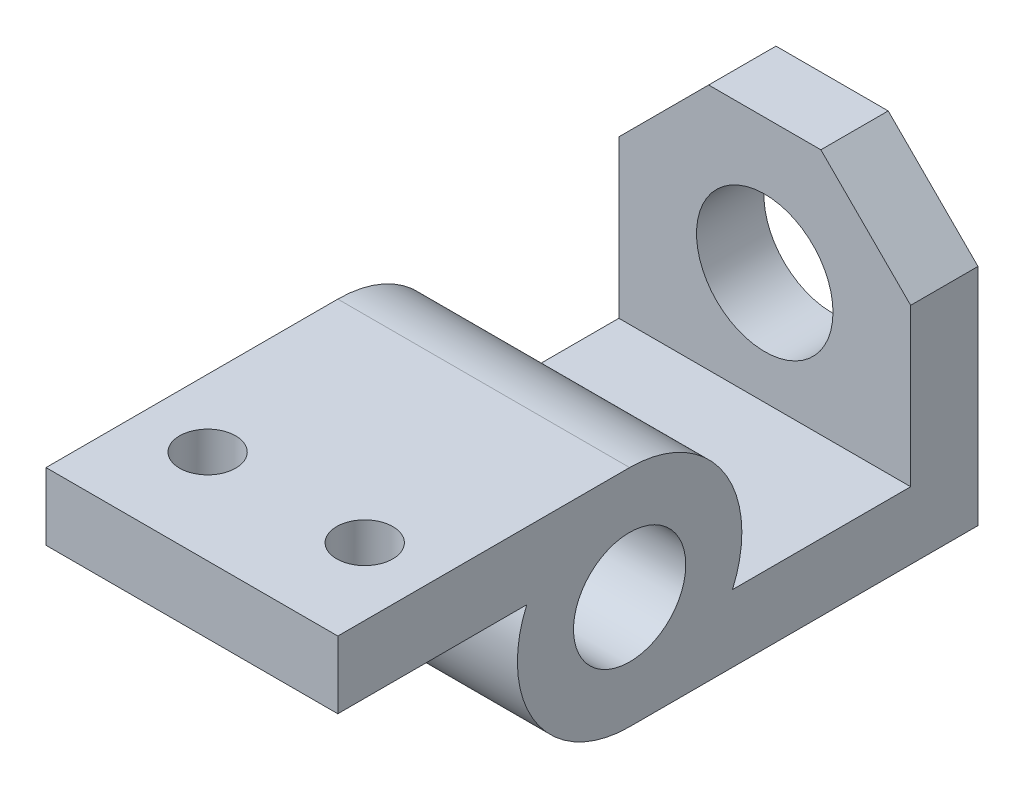
from build123d import *

# Parameters (mm, degrees)
SKETCH2_R           = 15.875
BOSS_EXTRUDE1_DEPTH = 82.55
SKETCH4_R           = 7.9375
CUT_EXTRUDE1_DEPTH  = 144.384968543
SKETCH5_R           = 19.304
CUT_EXTRUDE2_DEPTH  = 191.634403254


with BuildPart() as part:
    # Sketch2 → Boss-Extrude1 (new body)
    with BuildSketch(Plane(origin=(0, 0, 0), x_dir=(0, 0, -1), z_dir=(1, 0, 0))):
        with BuildLine():
            ThreePointArc((0, -31.75), (-26.563955842, -17.390191201), (-29.099355663, 12.7))
            Line((-29.099355663, 12.7), (-82.55, 12.7))
            Line((-82.55, 12.7), (-82.55, 31.75))
            Line((-82.55, 31.75), (0, 31.75))
            ThreePointArc((0, 31.75), (26.563955842, 17.390191201), (29.099355663, -12.7))
            Line((29.099355663, -12.7), (79.502, -12.7))
            Line((79.502, -12.7), (79.502, 57.15))
            Line((79.502, 57.15), (98.552, 57.15))
            Line((98.552, 57.15), (98.552, -31.75))
            Line((98.552, -31.75), (0, -31.75))
        make_face()
        Circle(SKETCH2_R, mode=Mode.SUBTRACT)
    extrude(amount=-BOSS_EXTRUDE1_DEPTH)

    # Sketch4 → Cut-Extrude1 (cut, through all)
    with BuildSketch(Plane(origin=(0, 31.75, 0), x_dir=(1, 0, 0), z_dir=(0, 1, 0))):
        with Locations(Location((-63.5, -55.88, 0), (0, 0, 270))):
            Circle(SKETCH4_R)
        with Locations(Location((-19.05, -55.88, 0), (0, 0, 270))):
            Circle(SKETCH4_R)
    extrude(amount=-CUT_EXTRUDE1_DEPTH, mode=Mode.SUBTRACT)

    # Sketch5 → Cut-Extrude2 (cut, through all)
    with BuildSketch(Plane.XY.offset(-79.502)):
        Polygon((-82.55, 31.75), (-57.15, 57.15), (-82.55, 57.15), align=None)
        Polygon((-25.4, 57.15), (0, 31.75), (0, 57.15), align=None)
        with Locations((-41.275, 19.05)):
            Circle(SKETCH5_R)
    extrude(amount=-CUT_EXTRUDE2_DEPTH, mode=Mode.SUBTRACT)


solid = part.part
